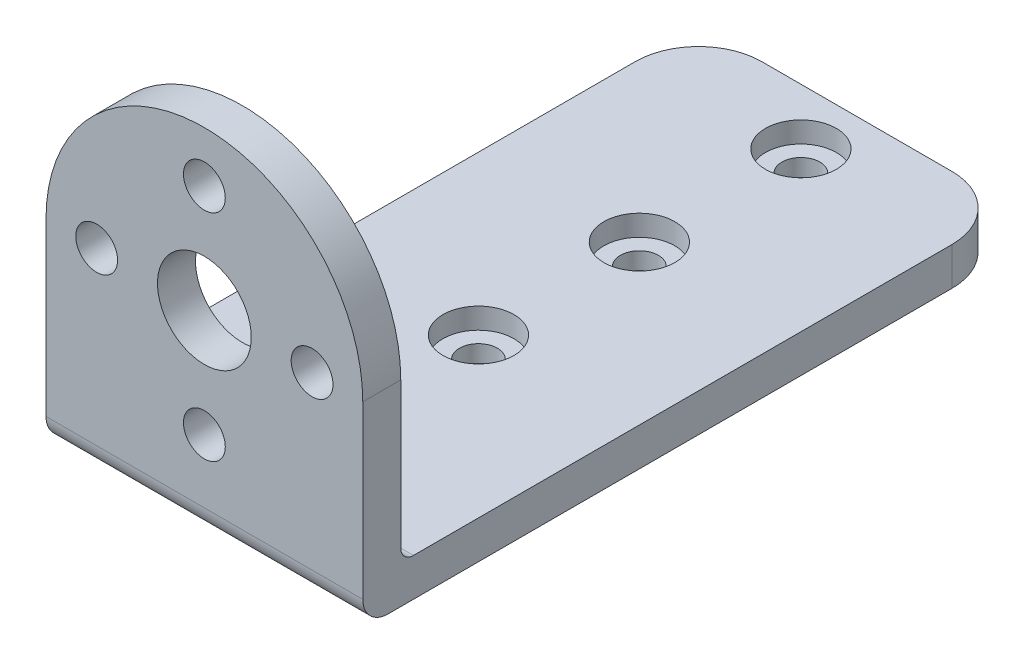
from build123d import *

# Parameters (mm, degrees)
ESBO_O1_W                = 25
ESBO_O1_H                = 51.5
RESSALTO_EXTRUS_O1_DEPTH = 3
ESBO_O4_W                = 25
ESBO_O4_H                = 3
RESSALTO_EXTRUS_O2_DEPTH = 25
ESBO_O5_R                = 1.65
ESBO_O5_R_2              = 3.7
CORTE_EXTRUS_O1_DEPTH    = 25
ESBO_O7_R                = 1.5
CORTE_EXTRUS_O2_DEPTH    = 25
FILETE1_R                = 5
FILETE2_R                = 2
FILETE3_R                = 1
ESBO_O8_R                = 2.8
CORTE_EXTRUS_O3_DEPTH    = 1.65


with BuildPart() as part:
    # Esboço1 → Ressalto-extrusão1 (new body)
    with BuildSketch(Plane(origin=(0, 0, 0), x_dir=(1, 0, 0), z_dir=(0, 1, 0))):
        with Locations((12.5, 25.75)):
            Rectangle(ESBO_O1_W, ESBO_O1_H)
    extrude(amount=RESSALTO_EXTRUS_O1_DEPTH)

    # Esboço4 → Ressalto-extrusão2 (add)
    with BuildSketch(Plane(origin=(0, 3, 0), x_dir=(1, 0, 0), z_dir=(0, 1, 0))):
        with Locations((12.5, 1.5)):
            Rectangle(ESBO_O4_W, ESBO_O4_H)
    extrude(amount=RESSALTO_EXTRUS_O2_DEPTH)

    # Esboço5 → Corte-extrusão1 (cut)
    with BuildSketch(Plane.XY):
        with Locations((4, 15.5)):
            Circle(ESBO_O5_R)
        with BuildLine():
            ThreePointArc((0, 15.5), (3.661165235, 24.338834765), (12.5, 28))
            Line((12.5, 28), (0, 28))
            Line((0, 28), (0, 15.5))
        make_face()
        with Locations((12.5, 24)):
            Circle(ESBO_O5_R)
        with Locations((12.5, 15.5)):
            Circle(ESBO_O5_R_2)
        with Locations((21, 15.5)):
            Circle(ESBO_O5_R)
        with Locations((12.5, 7)):
            Circle(ESBO_O5_R)
        with BuildLine():
            ThreePointArc((12.5, 28), (21.338834765, 24.338834765), (25, 15.5))
            Line((25, 15.5), (25, 28))
            Line((25, 28), (12.5, 28))
        make_face()
    extrude(amount=-CORTE_EXTRUS_O1_DEPTH, mode=Mode.SUBTRACT)

    # Esboço7 → Corte-extrusão2 (cut)
    with BuildSketch(Plane(origin=(0, 3, 0), x_dir=(1, 0, 0), z_dir=(0, 1, 0))):
        with Locations(Location((12.5, 34.33, 0), (0, 0, 270))):
            Circle(ESBO_O7_R)
        with Locations(Location((12.5, 21.63, 0), (0, 0, 270))):
            Circle(ESBO_O7_R)
        with Locations(Location((12.5, 8.93, 0), (0, 0, 270))):
            Circle(ESBO_O7_R)
        with Locations(Location((12.5, 47.08, 0), (0, 0, 270))):
            Circle(ESBO_O7_R)
    extrude(amount=-CORTE_EXTRUS_O2_DEPTH, mode=Mode.SUBTRACT)

    # Filete1
    filete1_edges = [part.edges().sort_by_distance(p)[0] for p in [
        (0, 1.5, -51.5),
        (25, 1.5, -51.5),
    ]]
    fillet(filete1_edges, radius=FILETE1_R)

    # Filete2
    filete2_edges = [part.edges().sort_by_distance(p)[0] for p in [
        (12.5, 0, 0),
    ]]
    fillet(filete2_edges, radius=FILETE2_R)

    # Filete3
    filete3_edges = [part.edges().sort_by_distance(p)[0] for p in [
        (12.5, 3, -3),
    ]]
    fillet(filete3_edges, radius=FILETE3_R)

    # Esboço8 → Corte-extrusão3 (cut)
    with BuildSketch(Plane(origin=(0, 3, 0), x_dir=(1, 0, 0), z_dir=(0, 1, 0))):
        with Locations(Location((12.5, 47.08, 0), (0, 0, 270))):
            Circle(ESBO_O8_R)
        with Locations(Location((12.5, 34.33, 0), (0, 0, 270))):
            Circle(ESBO_O8_R)
        with Locations(Location((12.5, 21.63, 0), (0, 0, 270))):
            Circle(ESBO_O8_R)
        with Locations(Location((12.5, 8.93, 0), (0, 0, 270))):
            Circle(ESBO_O8_R)
    extrude(amount=-CORTE_EXTRUS_O3_DEPTH, mode=Mode.SUBTRACT)


solid = part.part
